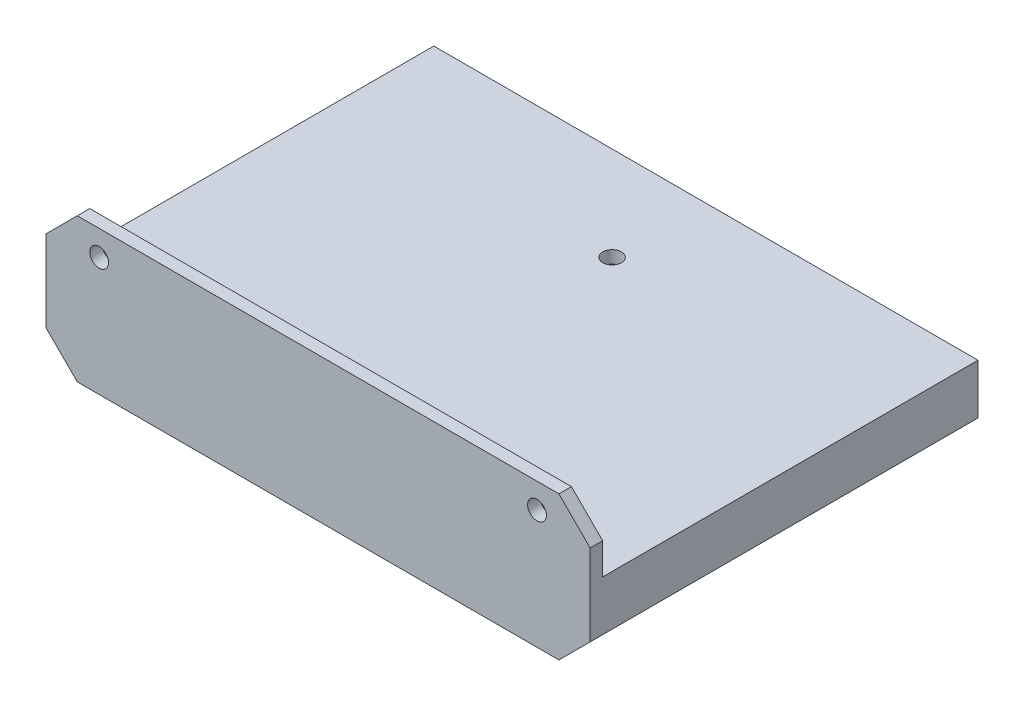
from build123d import *

# Parameters (mm, degrees)
EXTRUDE_1_DEPTH     = 60
SKETCH_2_W          = 87
SKETCH_2_H          = 23
EXTRUDE_2_DEPTH     = 2
SKETCH_3_R          = 1.5
CUT_EXTRUDE_1_DEPTH = 2
SKETCH_4_R          = 1.5
CUT_EXTRUDE_2_DEPTH = 5
SKETCH_5_R          = 4
CUT_EXTRUDE_3_DEPTH = 3
CHAMFER_1_SIZE      = 1
CHAMFER_2_SIZE      = 5


with BuildPart() as part:
    # Эскиз1 → Бобышка-Вытянуть1 (new body)
    with BuildSketch(Plane.XY):
        Polygon((30.5, 0), (38.5, 8), (-38.5, 8), (-30.5, 0), (-43.5, 0), (-43.5, 13), (43.5, 13), (43.5, 0), align=None)
    extrude(amount=EXTRUDE_1_DEPTH)

    # Эскиз2 → Бобышка-Вытянуть2 (add)
    with BuildSketch(Plane.XY.offset(60)):
        with Locations((0, 11.5)):
            Rectangle(SKETCH_2_W, SKETCH_2_H)
    extrude(amount=EXTRUDE_2_DEPTH)

    # Эскиз3 → Вырез-Вытянуть1 (cut)
    with BuildSketch(Plane.XY.offset(62)):
        with Locations((-35, 19)):
            Circle(SKETCH_3_R)
        with Locations(Location((35, 19, 0), (0, 0, 180))):
            Circle(SKETCH_3_R)
    extrude(amount=-CUT_EXTRUDE_1_DEPTH, mode=Mode.SUBTRACT)

    # Эскиз4 → Вырез-Вытянуть2 (cut)
    with BuildSketch(Plane.XZ.offset(-8)):
        with Locations((0, 15)):
            Circle(SKETCH_4_R)
    extrude(amount=-CUT_EXTRUDE_2_DEPTH, mode=Mode.SUBTRACT)

    # Эскиз5 → Вырез-Вытянуть3 (cut)
    with BuildSketch(Plane.XZ.offset(-8)):
        with Locations((0, 15)):
            Circle(SKETCH_5_R)
    extrude(amount=-CUT_EXTRUDE_3_DEPTH, mode=Mode.SUBTRACT)

    # Фаска1
    chamfer_1_edges = [part.edges().sort_by_distance(p)[0] for p in [
        (0, 8, 0),
        (-34.5, 4, 0),
        (34.5, 4, 0),
    ]]
    chamfer(chamfer_1_edges, length=CHAMFER_1_SIZE)

    # Фаска2
    chamfer_2_edges = [part.edges().sort_by_distance(p)[0] for p in [
        (43.5, 0, 31),
        (-43.5, 0, 31),
        (-43.5, 23, 61),
        (43.5, 23, 61),
    ]]
    chamfer(chamfer_2_edges, length=CHAMFER_2_SIZE)


solid = part.part
